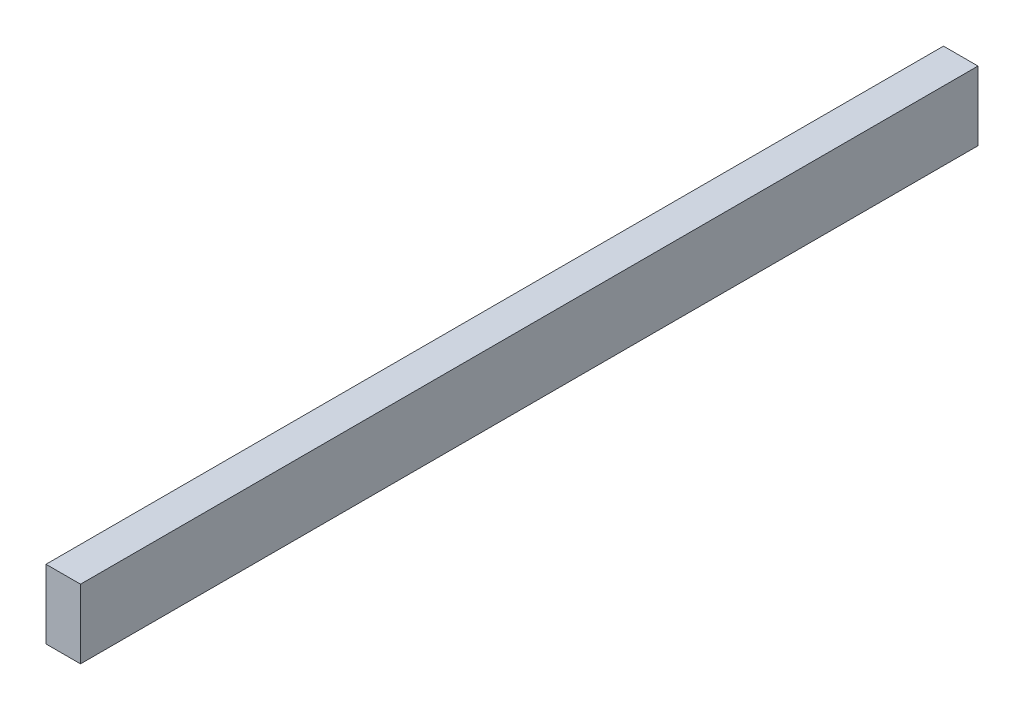
from build123d import *

# Parameters (mm, degrees)
SKETCH1_W           = 25.4
SKETCH1_H           = 660.4
BOSS_EXTRUDE1_DEPTH = 50.8


with BuildPart() as part:
    # Sketch1 → Boss-Extrude1 (new body)
    with BuildSketch(Plane(origin=(0, 0, 0), x_dir=(1, 0, 0), z_dir=(0, 1, 0))):
        with Locations((12.7, 330.2)):
            Rectangle(SKETCH1_W, SKETCH1_H)
    extrude(amount=BOSS_EXTRUDE1_DEPTH)


solid = part.part
